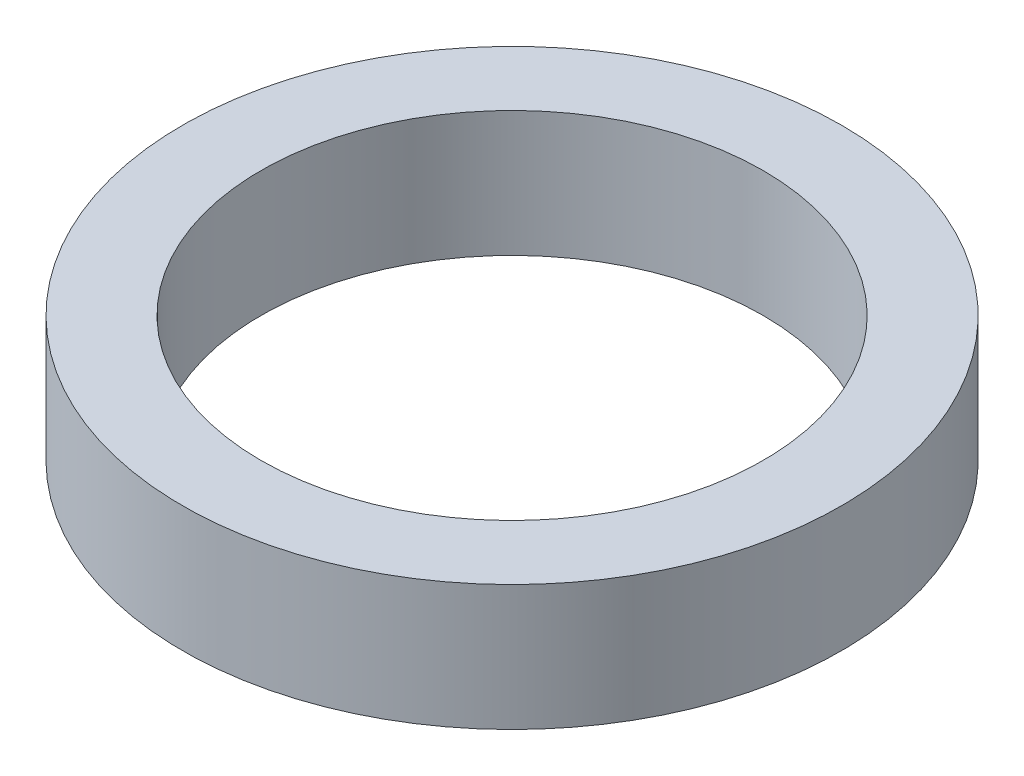
from build123d import *

# Parameters (mm, degrees)
RECONSTRUCTED_NOMINAL_AXIAL_PROFILE_W = 1.25
RECONSTRUCTED_NOMINAL_AXIAL_PROFILE_H = 2


with BuildPart() as part:
    # Reconstructed nominal axial profile → Native revolved geometry (revolve)
    with BuildSketch(Plane.XY, mode=Mode.PRIVATE) as native_revolved_geometry_sk:
        with Locations((4.625, -12)):
            Rectangle(RECONSTRUCTED_NOMINAL_AXIAL_PROFILE_W, RECONSTRUCTED_NOMINAL_AXIAL_PROFILE_H)
    revolve(native_revolved_geometry_sk.sketch.rotate(Axis((0, -500, 0), (0, 1, 0)), 90), axis=Axis((0, -500, 0), (0, 1, 0)))


solid = part.part
